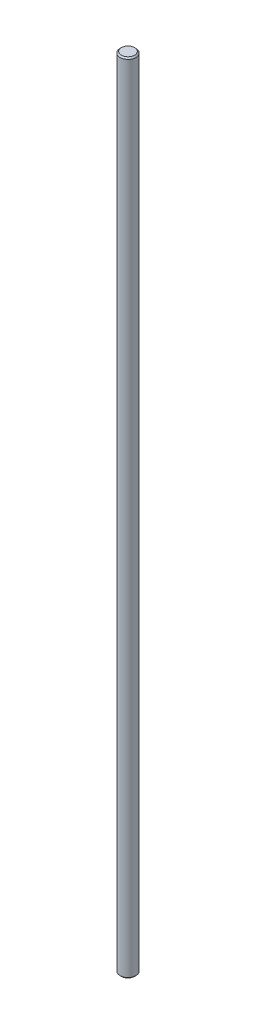
from build123d import *

# Parameters (mm, degrees)
SKETCH1_R           = 3
BOSS_EXTRUDE1_DEPTH = 302
CHAMFER1_SIZE       = 0.5
CHAMFER2_SIZE       = 0.5


with BuildPart() as part:
    # Sketch1 → Boss-Extrude1 (new body)
    with BuildSketch(Plane(origin=(0, 0, 0), x_dir=(1, 0, 0), z_dir=(0, 1, 0))):
        Circle(SKETCH1_R)
    extrude(amount=BOSS_EXTRUDE1_DEPTH)

    # Chamfer1
    chamfer1_edges = [part.edges().sort_by_distance(p)[0] for p in [
        (-3, 0, 0),
    ]]
    chamfer(chamfer1_edges, length=CHAMFER1_SIZE)

    # Chamfer2
    chamfer2_edges = [part.edges().sort_by_distance(p)[0] for p in [
        (-3, 302, 0),
    ]]
    chamfer(chamfer2_edges, length=CHAMFER2_SIZE)


solid = part.part
